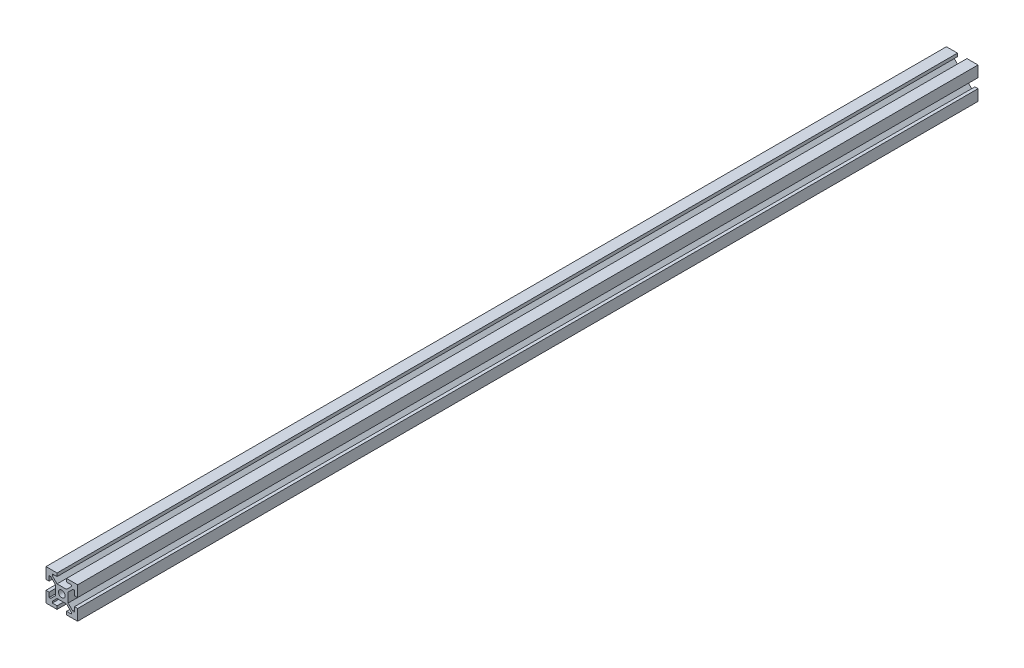
from build123d import *

# Parameters (mm, degrees)
SKETCH_2_R      = 2.1
EXTRUDE_1_DEPTH = 570


with BuildPart() as part:
    # ｽｹｯﾁ2 → ﾎﾞｽ - 押し出し1 (new body)
    with BuildSketch(Plane.XY):
        Polygon((3, 4), (-3, 4), (-6, 7), (-6, 8), (-3, 8), (-3, 10), (-10, 10), (-10, 3), (-8, 3), (-8, 6), (-7, 6), (-4, 3), (-4, -3), (-7, -6), (-8, -6), (-8, -3), (-10, -3), (-10, -10), (-3, -10), (-3, -8), (-6, -8), (-6, -7), (-3, -4), (3, -4), (6, -7), (6, -8), (3, -8), (3, -10), (10, -10), (10, -3), (8, -3), (8, -6), (7, -6), (4, -3), (4, 3), (7, 6), (8, 6), (8, 3), (10, 3), (10, 10), (3, 10), (3, 8), (6, 8), (6, 7), align=None)
        Circle(SKETCH_2_R, mode=Mode.SUBTRACT)
    extrude(amount=EXTRUDE_1_DEPTH)


solid = part.part
